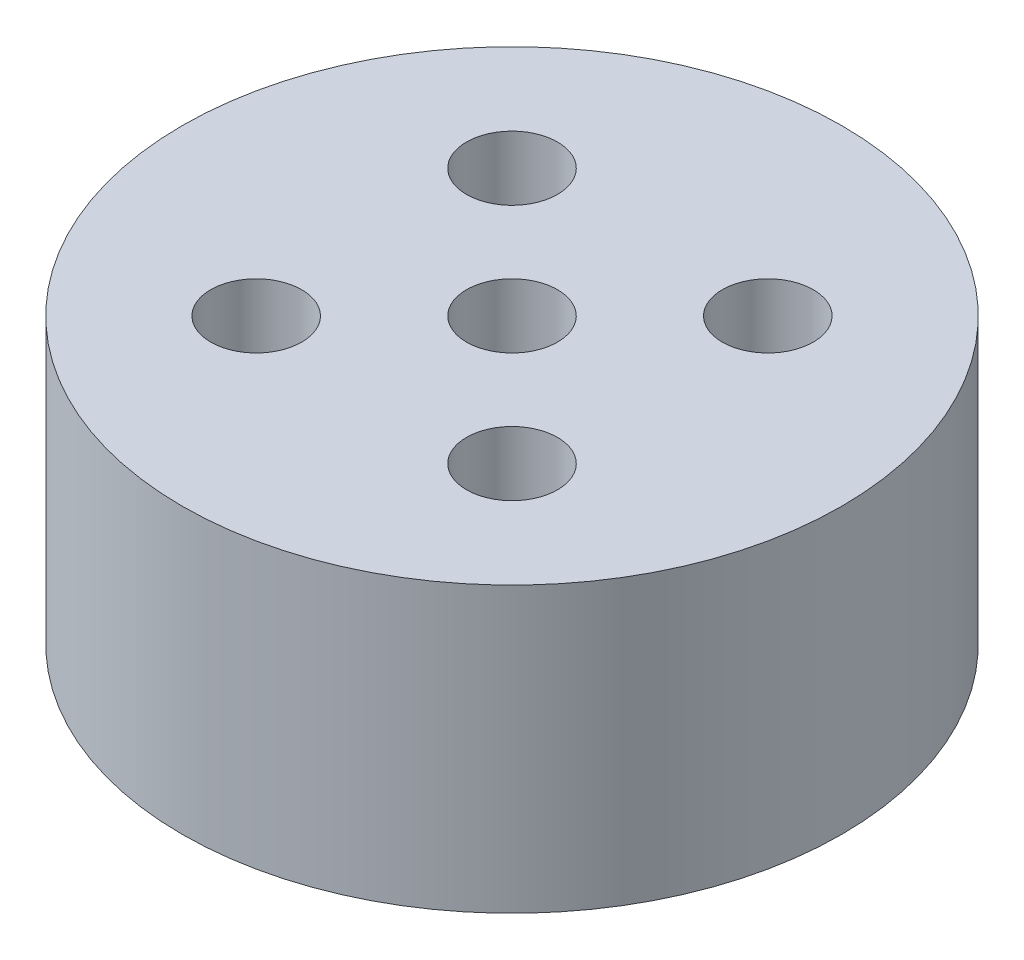
from build123d import *

# Parameters (mm, degrees)
SKETCH1_R           = 14.732
BOSS_EXTRUDE1_DEPTH = 12.7
SKETCH2_R           = 2.032
CUT_EXTRUDE1_DEPTH  = 12.7


with BuildPart() as part:
    # Sketch1 → Boss-Extrude1 (new body)
    with BuildSketch(Plane(origin=(0, 0, 0), x_dir=(1, 0, 0), z_dir=(0, 1, 0))):
        with Locations(Location((-14.720932897, 5.387100013, 0), (0, 0, 270))):
            Circle(SKETCH1_R)
    extrude(amount=BOSS_EXTRUDE1_DEPTH)

    # Sketch2 → Cut-Extrude1 (cut)
    with BuildSketch(Plane(origin=(0, 12.7, 0), x_dir=(1, 0, 0), z_dir=(0, 1, 0))):
        with Locations(Location((-9.005932897, -0.327899987, 0), (0, 0, 270))):
            Circle(SKETCH2_R)
        with Locations(Location((-9.005932897, 11.102100013, 0), (0, 0, 270))):
            Circle(SKETCH2_R)
        with Locations(Location((-20.435932897, 11.102100013, 0), (0, 0, 270))):
            Circle(SKETCH2_R)
        with Locations(Location((-20.435932897, -0.327899987, 0), (0, 0, 270))):
            Circle(SKETCH2_R)
        with Locations(Location((-14.720932897, 5.387100013, 0), (0, 0, 270))):
            Circle(SKETCH2_R)
    extrude(amount=-CUT_EXTRUDE1_DEPTH, mode=Mode.SUBTRACT)


solid = part.part
